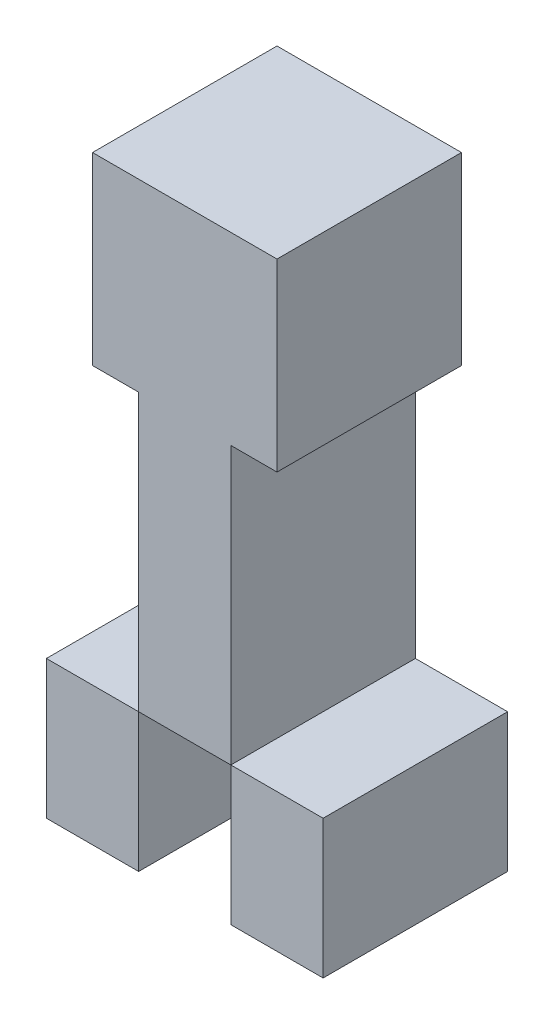
from build123d import *

# Parameters (mm, degrees)
SKETCH1_W           = 76
SKETCH1_H           = 152
SKETCH1_W_2         = 70
SKETCH1_H_2         = 146
BOSS_EXTRUDE1_DEPTH = 114
SKETCH4_W           = 70
SKETCH4_H           = 3
BOSS_EXTRUDE2_DEPTH = 146
SKETCH5_W           = 76
SKETCH5_H           = 152
SKETCH5_W_2         = 70
SKETCH5_H_2         = 146
BOSS_EXTRUDE3_DEPTH = 228
SKETCH6_W           = 152
SKETCH6_H           = 152
BOSS_EXTRUDE4_DEPTH = 152


with BuildPart() as part:
    # Sketch1 → Boss-Extrude1 (new body)
    with BuildSketch(Plane(origin=(0, 0, 0), x_dir=(1, 0, 0), z_dir=(0, 1, 0))):
        with Locations((-76, 76)):
            Rectangle(SKETCH1_W, SKETCH1_H)
        with Locations((-76, 76)):
            Rectangle(SKETCH1_W_2, SKETCH1_H_2, mode=Mode.SUBTRACT)
    extrude(amount=BOSS_EXTRUDE1_DEPTH)

    # Sketch4 → Boss-Extrude2 (add)
    with BuildSketch(Plane.XY.offset(-149)):
        with Locations((-76, 112.5)):
            Rectangle(SKETCH4_W, SKETCH4_H)
    extrude(amount=BOSS_EXTRUDE2_DEPTH)


with BuildPart() as body_2:
    # Mirror2: mirrored copy
    add(part.part.mirror(Plane(origin=(0, 0, 0), x_dir=(0, 0, 1), z_dir=(1, 0, 0))))


with BuildPart() as body_3:
    # Sketch5 → Boss-Extrude3 (new body)
    with BuildSketch(Plane(origin=(0, 114, 0), x_dir=(1, 0, 0), z_dir=(0, 1, 0))):
        with Locations((0, 76)):
            Rectangle(SKETCH5_W, SKETCH5_H)
        with Locations((0, 76)):
            Rectangle(SKETCH5_W_2, SKETCH5_H_2, mode=Mode.SUBTRACT)
    extrude(amount=BOSS_EXTRUDE3_DEPTH)

    # Sketch6 → Boss-Extrude4 (add)
    with BuildSketch(Plane(origin=(0, 0, -152), x_dir=(-1, 0, 0), z_dir=(0, 0, -1))):
        with Locations((0, 418)):
            Rectangle(SKETCH6_W, SKETCH6_H)
    extrude(amount=-BOSS_EXTRUDE4_DEPTH)


solid = Compound([part.part, body_2.part, body_3.part])
